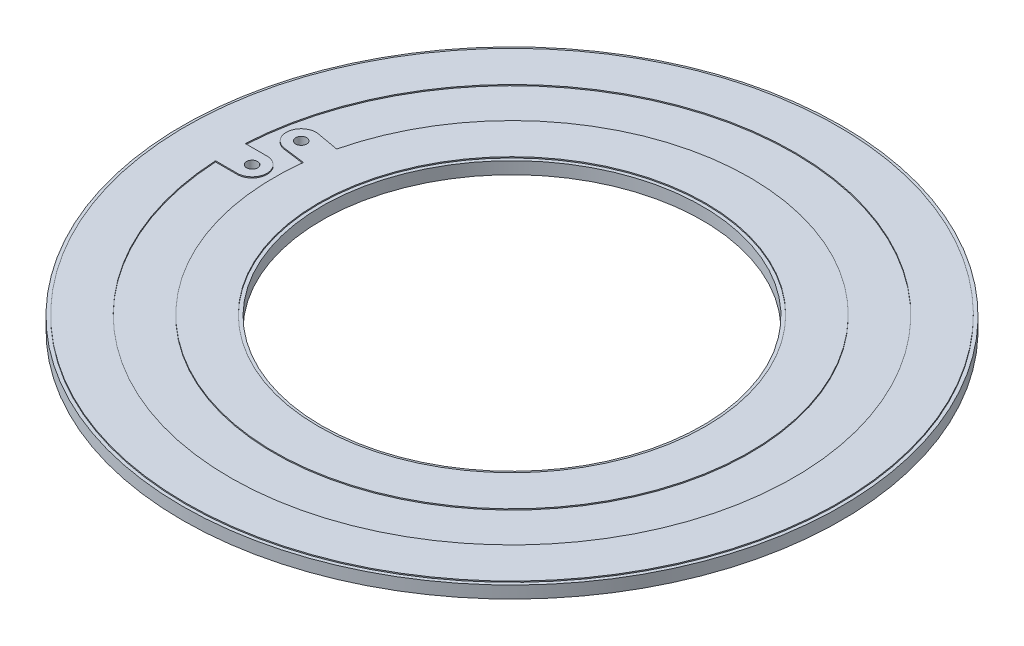
from build123d import *

# Parameters (mm, degrees)
SKETCH_1_R               = 29.8
SKETCH_1_R_2             = 17.2
EXTRUDE_1_DEPTH          = 1.1
SKETCH_2_R               = 29.5
SKETCH_2_R_2             = 25.5
SKETCH_2_R_3             = 21.5
SKETCH_2_R_4             = 17.5
EXTRUDE_2_DEPTH          = 0.1
SKETCH_4_R               = 0.5
CUT_EXTRUDE_1_DEPTH      = 43.157917406
EXTRUDE_START            = 0.1
SKETCH_5_R               = 1.345948063
SKETCH_5_R_2             = 0.5
EXTRUDE_3_DEPTH          = 0.1
PATTERN_CIRCULAR_1_COUNT = 2
PATTERN_CIRCULAR_1_ANGLE = 10
EXTRUDE_4_DEPTH          = 0.1


with BuildPart() as part:
    # Эскиз1 → Бобышка-Вытянуть1 (new body)
    with BuildSketch(Plane(origin=(0, 0, 0), x_dir=(1, 0, 0), z_dir=(0, 1, 0))):
        with Locations(Location((0, 0, 0), (0, 0, 270))):
            Circle(SKETCH_1_R)
        with Locations(Location((0, 0, 0), (0, 0, 270))):
            Circle(SKETCH_1_R_2, mode=Mode.SUBTRACT)
    extrude(amount=EXTRUDE_1_DEPTH)

    # Эскиз2 → Бобышка-Вытянуть2 (add)
    # profile 1 of 2: a face of its own
    with BuildSketch(Plane(origin=(0, 1.1, 0), x_dir=(1, 0, 0), z_dir=(0, 1, 0))):
        with Locations(Location((0, 0, 0), (0, 0, 270))):
            Circle(SKETCH_2_R)
        with Locations(Location((0, 0, 0), (0, 0, 270))):
            Circle(SKETCH_2_R_2, mode=Mode.SUBTRACT)
    # profile 2 of 2: a face of its own
    with BuildSketch(Plane(origin=(0, 1.1, 0), x_dir=(1, 0, 0), z_dir=(0, 1, 0))):
        with Locations(Location((0, 0, 0), (0, 0, 270))):
            Circle(SKETCH_2_R_3)
        with Locations(Location((0, 0, 0), (0, 0, 270))):
            Circle(SKETCH_2_R_4, mode=Mode.SUBTRACT)
    extrude(amount=EXTRUDE_2_DEPTH)

    # Эскиз4 → Вырез-Вытянуть1 (cut, through all)
    with BuildSketch(Plane(origin=(0, 1.1, 0), x_dir=(1, 0, 0), z_dir=(0, 1, 0))):
        with Locations(Location((-23.5, 0, 0), (0, 0, 270))):
            Circle(SKETCH_4_R)
    cut_extrude_1 = extrude(amount=-CUT_EXTRUDE_1_DEPTH, mode=Mode.SUBTRACT)

    # Эскиз5 → Бобышка-Вытянуть3 (add)
    with BuildSketch(Plane(origin=(0, 1.1, 0), x_dir=(1, 0, 0), z_dir=(0, 1, 0)).offset(EXTRUDE_START)):
        with Locations(Location((-23.5, 0, 0), (0, 0, 270))):
            Circle(SKETCH_5_R)
        with Locations(Location((-23.5, 0, 0), (0, 0, 270))):
            Circle(SKETCH_5_R_2, mode=Mode.SUBTRACT)
    extrude_3 = extrude(amount=-EXTRUDE_3_DEPTH)

    # Круговой массив1: Вырез-Вытянуть1, Бобышка-Вытянуть3 ×2 about axis
    pattern_circular_1_axis = Axis((0, 1.1, 0), (0, -1, 0))
    add([cut_extrude_1.rotate(pattern_circular_1_axis, i * PATTERN_CIRCULAR_1_ANGLE / (PATTERN_CIRCULAR_1_COUNT - 1)) for i in range(1, PATTERN_CIRCULAR_1_COUNT)], mode=Mode.SUBTRACT)
    add([extrude_3.rotate(pattern_circular_1_axis, i * PATTERN_CIRCULAR_1_ANGLE / (PATTERN_CIRCULAR_1_COUNT - 1)) for i in range(1, PATTERN_CIRCULAR_1_COUNT)])

    # Эскиз6 → Бобышка-Вытянуть4 (add)
    with BuildSketch(Plane(origin=(0, 1.1, 0), x_dir=(1, 0, 0), z_dir=(0, 1, 0))):
        with BuildLine():
            Line((-22.800516228, 5.382382378), (-20.899198346, 5.047128736))
            ThreePointArc((-20.899198346, 5.047128736), (-21.165886934, 3.775609923), (-21.355289338, 2.490304658))
            Line((-21.355289338, 2.490304658), (-23.266360042, 2.740450826))
            ThreePointArc((-23.266360042, 2.740450826), (-21.817482108, 3.847010747), (-22.800516228, 5.382382378))
        make_face()
        Polygon((-23.5, -1.345948063), (-27.456522895, -1.345948063), (-27.456522895, 1.345948063), (-23.5, 1.345948063), (-24.412849666, 0), align=None)
    extrude(amount=EXTRUDE_4_DEPTH)


solid = part.part
